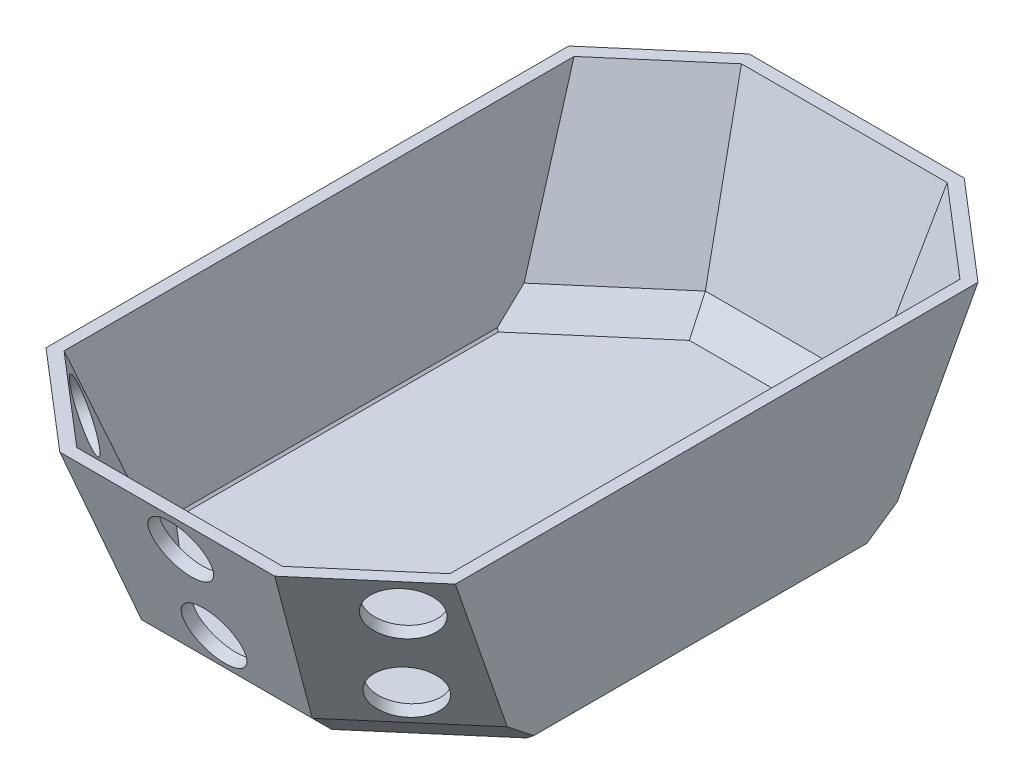
from build123d import *
from OCP.BRepFilletAPI import BRepFilletAPI_MakeChamfer

# Parameters (mm, degrees)
SKETCH1_W             = 96.449496644
SKETCH1_H             = 93.866027984
BOSS_EXTRUDE1_DEPTH   = 50
DRAFT1_ANGLE          = 20
DRAFT2_ANGLE          = 5
CHAMFER1_SIZE         = 5
CHAMFER1_SIZE2        = 8.365785926
CHAMFER1_EDGE_2_SIZE  = 5
CHAMFER1_EDGE_2_SIZE2 = 8.365785926
CHAMFER1_EDGE_3_SIZE  = 5
CHAMFER1_EDGE_3_SIZE2 = 8.365785926
CHAMFER1_EDGE_4_SIZE  = 5
CHAMFER1_EDGE_4_SIZE2 = 8.365785926
CHAMFER1_EDGE_5_SIZE  = 5
CHAMFER1_EDGE_5_SIZE2 = 8.365785926
CHAMFER1_EDGE_6_SIZE  = 5
CHAMFER1_EDGE_6_SIZE2 = 8.365785926
CHAMFER2_SIZE         = 2
CHAMFER2_SIZE2        = 2.200125735
SHELL1_T              = -3
SKETCH2_R             = 8
CUT_EXTRUDE1_DEPTH    = 174.798113009
SKETCH3_R             = 8
CUT_EXTRUDE2_DEPTH    = 173.570101234


with BuildPart() as part:
    # Sketch1 → Boss-Extrude1 (new body)
    with BuildSketch(Plane(origin=(0, 0, 0), x_dir=(1, 0, 0), z_dir=(0, 1, 0))):
        Rectangle(SKETCH1_W, SKETCH1_H)
        Polygon((20.883038336, 70.399520989), (48.224748322, 46.933013992), (-48.224748322, 46.933013992), (-20.883038336, 70.399520989), align=None)
        Polygon((-48.224748322, -46.933013992), (48.224748322, -46.933013992), (20.883038336, -70.399520989), (-20.883038336, -70.399520989), align=None)
    extrude(amount=BOSS_EXTRUDE1_DEPTH)

    # Draft1
    draft1_faces = [part.faces().sort_by_distance(p)[0] for p in [
        (-34.553893329, 25, 58.66626749),
        (-34.553893329, 25, -58.66626749),
        (0, 25, -70.399520989),
        (34.553893329, 25, -58.66626749),
        (34.553893329, 25, 58.66626749),
        (0, 25, 70.399520989),
    ]]
    draft(draft1_faces, Plane(origin=(0, 0, 0), x_dir=(0, 0, -1), z_dir=(0, -1, 0)), DRAFT1_ANGLE)

    # Draft2
    draft2_faces = [part.faces().sort_by_distance(p)[0] for p in [
        (48.224748322, 26.695838409, 0),
        (-48.224748322, 26.695838409, 0),
    ]]
    draft(draft2_faces, Plane(origin=(0, 0, 0), x_dir=(0, 0, -1), z_dir=(0, -1, 0)), DRAFT2_ANGLE)

    # Chamfer1
    chamfer1_edges = [part.edges().sort_by_distance(p)[0] for p in [
        (0, 0, 70.399520989),
    ]]
    chamfer1_side = [part.faces().sort_by_distance(p)[0] for p in [
        (0, 0, 0),
    ]]
    chamfer(chamfer1_edges, length=CHAMFER1_SIZE, length2=CHAMFER1_SIZE2, reference=chamfer1_side[0])

    # Chamfer1 edge 2
    chamfer1_edge_2_edges = [part.edges().sort_by_distance(p)[0] for p in [
        (-34.553893329, 0, 58.66626749),
    ]]
    chamfer1_edge_2_side = [part.faces().sort_by_distance(p)[0] for p in [
        (0, 0, 0),
    ]]
    chamfer(chamfer1_edge_2_edges, length=CHAMFER1_EDGE_2_SIZE, length2=CHAMFER1_EDGE_2_SIZE2, reference=chamfer1_edge_2_side[0])

    # Chamfer1 edge 3
    chamfer1_edge_3_edges = [part.edges().sort_by_distance(p)[0] for p in [
        (-34.553893329, 0, -58.66626749),
    ]]
    chamfer1_edge_3_side = [part.faces().sort_by_distance(p)[0] for p in [
        (0, 0, 0),
    ]]
    chamfer(chamfer1_edge_3_edges, length=CHAMFER1_EDGE_3_SIZE, length2=CHAMFER1_EDGE_3_SIZE2, reference=chamfer1_edge_3_side[0])

    # Chamfer1 edge 4
    chamfer1_edge_4_edges = [part.edges().sort_by_distance(p)[0] for p in [
        (0, 0, -70.399520989),
    ]]
    chamfer1_edge_4_side = [part.faces().sort_by_distance(p)[0] for p in [
        (0, 0, 0),
    ]]
    chamfer(chamfer1_edge_4_edges, length=CHAMFER1_EDGE_4_SIZE, length2=CHAMFER1_EDGE_4_SIZE2, reference=chamfer1_edge_4_side[0])

    # Chamfer1 edge 5
    chamfer1_edge_5_edges = [part.edges().sort_by_distance(p)[0] for p in [
        (34.553893329, 0, -58.66626749),
    ]]
    chamfer1_edge_5_side = [part.faces().sort_by_distance(p)[0] for p in [
        (0, 0, 0),
    ]]
    chamfer(chamfer1_edge_5_edges, length=CHAMFER1_EDGE_5_SIZE, length2=CHAMFER1_EDGE_5_SIZE2, reference=chamfer1_edge_5_side[0])

    # Chamfer1 edge 6
    chamfer1_edge_6_edges = [part.edges().sort_by_distance(p)[0] for p in [
        (34.553893329, 0, 58.66626749),
    ]]
    chamfer1_edge_6_side = [part.faces().sort_by_distance(p)[0] for p in [
        (0, 0, 0),
    ]]
    chamfer(chamfer1_edge_6_edges, length=CHAMFER1_EDGE_6_SIZE, length2=CHAMFER1_EDGE_6_SIZE2, reference=chamfer1_edge_6_side[0])

    # Chamfer2: one chamfer whose edges measure the first distance from different faces: ONE call of the kernel's chamfer builder (chamfer() names one face for all edges)
    chamfer2_edges_1 = [part.edges().sort_by_distance(p)[0] for p in [
        (48.224748322, 0, 0),
    ]]
    chamfer2_side_1 = [part.faces().sort_by_distance(p)[0] for p in [
        (50.560348002, 26.696026495, 0),
    ]]
    chamfer2_edges_2 = [part.edges().sort_by_distance(p)[0] for p in [
        (-48.224748322, 0, 0),
    ]]
    chamfer2_side_2 = [part.faces().sort_by_distance(p)[0] for p in [
        (0, 0, 0),
    ]]
    chamfer2 = BRepFilletAPI_MakeChamfer(part.part.solid().wrapped)
    for e in chamfer2_edges_1:
        chamfer2.Add(CHAMFER2_SIZE, CHAMFER2_SIZE2, e.wrapped, chamfer2_side_1[0].wrapped)  # the first distance lies on this face
    for e in chamfer2_edges_2:
        chamfer2.Add(CHAMFER2_SIZE, CHAMFER2_SIZE2, e.wrapped, chamfer2_side_2[0].wrapped)  # the first distance lies on this face
    add(Compound.cast(chamfer2.Shape()), mode=Mode.REPLACE)

    # Shell1
    shell1_openings = [part.faces().sort_by_distance(p)[0] for p in [
        (0, 50, 0),
    ]]
    offset(amount=SHELL1_T, openings=shell1_openings, kind=Kind.INTERSECTION)

    # Sketch2 → Cut-Extrude1 (cut, through all)
    with BuildSketch(Plane(origin=(36.708388619, -20.5145146, 42.770324355), x_dir=(-0.7908530317789993, -0.26467423150818037, 0.5518143105262125), z_dir=(-0.6120061128174825, 0.3420201433256695, -0.7130713424570668))):
        with Locations(Location((-5.537538823, 67.111220428, 0), (0, 0, 16.359329629))):
            Circle(SKETCH2_R)
        with Locations(Location((1.503972029, 43.123366733, 0), (0, 0, 16.359329629))):
            Circle(SKETCH2_R)
    cut_extrude1 = extrude(amount=-CUT_EXTRUDE1_DEPTH, mode=Mode.SUBTRACT)

    # Sketch3 → Cut-Extrude2 (cut, through all)
    with BuildSketch(Plane(origin=(0, -21.59990948, 59.345263558), x_dir=(-1, 0, 0), z_dir=(0, 0.34202014332566943, -0.9396926207859082))):
        with Locations(Location((0, 67.108924172, 0), (0, 0, 90))):
            Circle(SKETCH3_R)
        with Locations(Location((0, 42.108924172, 0), (0, 0, 90))):
            Circle(SKETCH3_R)
    extrude(amount=-CUT_EXTRUDE2_DEPTH, mode=Mode.SUBTRACT)

    # Mirror1: Cut-Extrude1 across plane
    add(cut_extrude1.mirror(Plane(origin=(0, 0, 0), x_dir=(0, 0, 1), z_dir=(1, 0, 0))), mode=Mode.SUBTRACT)


solid = part.part
